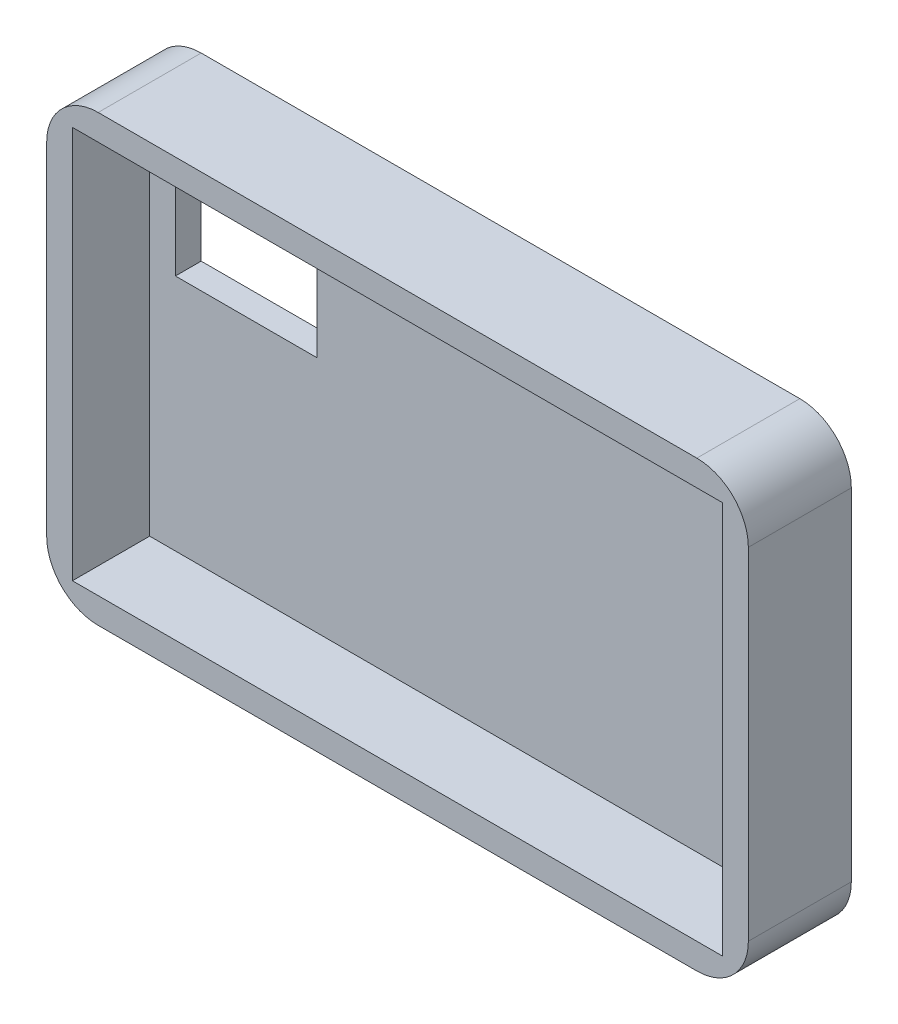
from build123d import *

# Parameters (mm, degrees)
SKETCH2_W           = 54.5
SKETCH2_H           = 34.5
BOSS_EXTRUDE1_DEPTH = 8
SHELL1_T            = -2
FILLET2_R           = 4
SKETCH3_W           = 11
SKETCH3_H           = 11
CUT_EXTRUDE1_DEPTH  = 26


with BuildPart() as part:
    # Sketch2 → Boss-Extrude1 (new body)
    with BuildSketch(Plane.XY):
        Rectangle(SKETCH2_W, SKETCH2_H)
    extrude(amount=BOSS_EXTRUDE1_DEPTH)

    # Shell1
    shell1_openings = [part.faces().sort_by_distance(p)[0] for p in [
        (0, 0, 8),
    ]]
    offset(amount=SHELL1_T, openings=shell1_openings, kind=Kind.INTERSECTION)

    # Fillet2
    fillet2_edges = [part.edges().sort_by_distance(p)[0] for p in [
        (27.25, -17.25, 4),
        (-27.25, -17.25, 4),
        (-27.25, 17.25, 4),
        (27.25, 17.25, 4),
    ]]
    fillet(fillet2_edges, radius=FILLET2_R)

    # Sketch3 → Cut-Extrude1 (cut)
    with BuildSketch(Plane(origin=(0, 0, -10), x_dir=(-1, 0, 0), z_dir=(0, 0, -1))):
        with Locations((17.75, 8.75)):
            Rectangle(SKETCH3_W, SKETCH3_H)
    extrude(amount=-CUT_EXTRUDE1_DEPTH, mode=Mode.SUBTRACT)


solid = part.part
